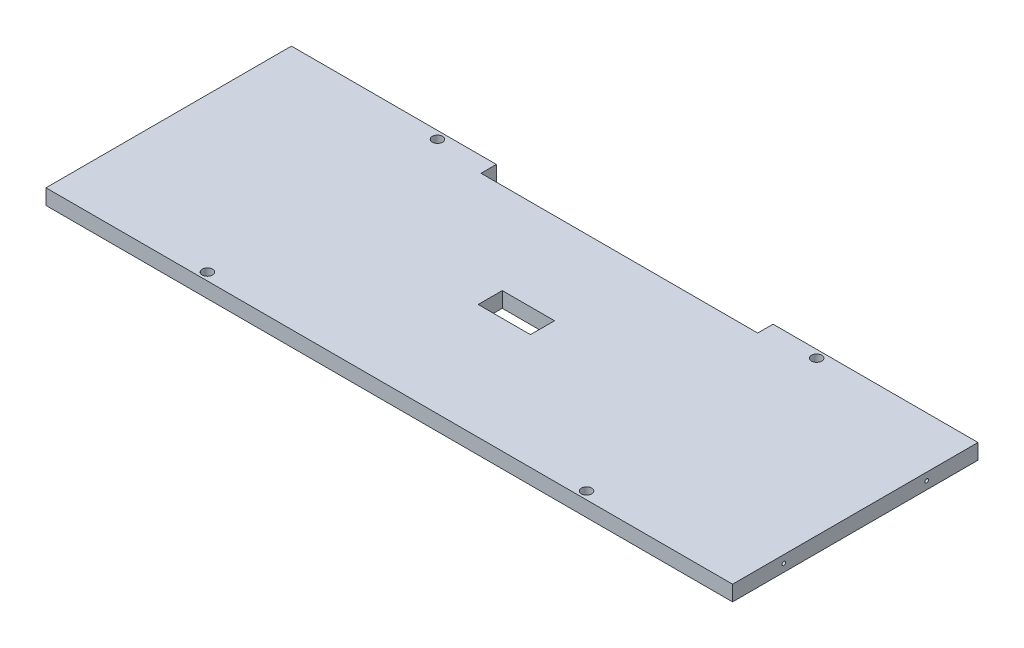
from build123d import *

# Parameters (mm, degrees)
SKETCH_1_W          = 134
SKETCH_1_H          = 3
EXTRUDE_1_DEPTH     = 47.9
SKETCH_4_R          = 0.7
SKETCH_4_W          = 10.2
SKETCH_4_H          = 4.7
SKETCH_4_W_2        = 54
SKETCH_4_H_2        = 3
CUT_EXTRUDE_1_DEPTH = 83.416078528
SKETCH_4_3_R        = 1
SKETCH_4_3_R_2      = 0.7
SKETCH_4_3_W        = 10.2
SKETCH_4_3_H        = 4.7
SKETCH_4_3_W_2      = 54
SKETCH_4_3_H_2      = 3
CUT_EXTRUDE_2_DEPTH = 1.5
SKETCH_5_R          = 0.35
CUT_EXTRUDE_3_DEPTH = 1.5
SKETCH_6_R          = 0.35
CUT_EXTRUDE_4_DEPTH = 1.5
SKETCH_7_R          = 0.35
CUT_EXTRUDE_5_DEPTH = 1.5
CUT_EXTRUDE_START   = -132.5
SKETCH_7_3_R        = 0.35
CUT_EXTRUDE_6_DEPTH = 1.5


with BuildPart() as part:
    # 草图1 → 凸台-拉伸1 (new body)
    with BuildSketch(Plane.XY):
        Rectangle(SKETCH_1_W, SKETCH_1_H)
    extrude(amount=EXTRUDE_1_DEPTH)

    # 草图4 → 切除-拉伸1 (cut, through all)
    with BuildSketch(Plane(origin=(0, 1.5, 0), x_dir=(1, 0, 0), z_dir=(0, 1, 0))):
        with Locations(Location((37, -46.4, 0), (0, 0, 270))):
            Circle(SKETCH_4_R)
        with Locations(Location((-37, -46.4, 0), (0, 0, 270))):
            Circle(SKETCH_4_R)
        with Locations((0, -23.1)):
            Rectangle(SKETCH_4_W, SKETCH_4_H)
        with Locations((0, -1.5)):
            Rectangle(SKETCH_4_W_2, SKETCH_4_H_2)
        with Locations(Location((-37, -1.5, 0), (0, 0, 270))):
            Circle(SKETCH_4_R)
        with Locations(Location((37, -1.5, 0), (0, 0, 270))):
            Circle(SKETCH_4_R)
    extrude(amount=-CUT_EXTRUDE_1_DEPTH, mode=Mode.SUBTRACT)

    # 草图4<3> → 切除-拉伸2 (cut)
    # profile 1 of 6: a face of its own
    with BuildSketch(Plane(origin=(0, 1.5, 0), x_dir=(1, 0, 0), z_dir=(0, 1, 0))):
        with Locations(Location((-37, -46.4, 0), (0, 0, 270))):
            Circle(SKETCH_4_3_R)
        with Locations(Location((-37, -46.4, 0), (0, 0, 270))):
            Circle(SKETCH_4_3_R_2, mode=Mode.SUBTRACT)
    # profile 2 of 6: a face of its own
    with BuildSketch(Plane(origin=(0, 1.5, 0), x_dir=(1, 0, 0), z_dir=(0, 1, 0))):
        with Locations(Location((37, -46.4, 0), (0, 0, 270))):
            Circle(SKETCH_4_3_R)
        with Locations(Location((37, -46.4, 0), (0, 0, 270))):
            Circle(SKETCH_4_3_R_2, mode=Mode.SUBTRACT)
    # profile 3 of 6: a face of its own
    with BuildSketch(Plane(origin=(0, 1.5, 0), x_dir=(1, 0, 0), z_dir=(0, 1, 0))):
        with Locations(Location((37, -1.5, 0), (0, 0, 270))):
            Circle(SKETCH_4_3_R)
        with Locations(Location((37, -1.5, 0), (0, 0, 270))):
            Circle(SKETCH_4_3_R_2, mode=Mode.SUBTRACT)
    # profile 4 of 6: a face of its own
    with BuildSketch(Plane(origin=(0, 1.5, 0), x_dir=(1, 0, 0), z_dir=(0, 1, 0))):
        with Locations(Location((-37, -1.5, 0), (0, 0, 270))):
            Circle(SKETCH_4_3_R)
        with Locations(Location((-37, -1.5, 0), (0, 0, 270))):
            Circle(SKETCH_4_3_R_2, mode=Mode.SUBTRACT)
    # profile 5 of 6: a face of its own
    with BuildSketch(Plane(origin=(0, 1.5, 0), x_dir=(1, 0, 0), z_dir=(0, 1, 0))):
        with Locations((0, -23.1)):
            Rectangle(SKETCH_4_3_W, SKETCH_4_3_H)
    # profile 6 of 6: a face of its own
    with BuildSketch(Plane(origin=(0, 1.5, 0), x_dir=(1, 0, 0), z_dir=(0, 1, 0))):
        with Locations((0, -1.5)):
            Rectangle(SKETCH_4_3_W_2, SKETCH_4_3_H_2)
    extrude(amount=-CUT_EXTRUDE_2_DEPTH, mode=Mode.SUBTRACT)

    # 草图5 → 切除-拉伸3 (cut)
    with BuildSketch(Plane.XZ.offset(1.5)):
        with Locations((42.3, 22.35)):
            Circle(SKETCH_5_R)
        with Locations((-42.3, 22.35)):
            Circle(SKETCH_5_R)
    extrude(amount=-CUT_EXTRUDE_3_DEPTH, mode=Mode.SUBTRACT)

    # 草图6 → 切除-拉伸4 (cut)
    with BuildSketch(Plane(origin=(0, 0, 3), x_dir=(-1, 0, 0), z_dir=(0, 0, -1))):
        Circle(SKETCH_6_R)
    extrude(amount=-CUT_EXTRUDE_4_DEPTH, mode=Mode.SUBTRACT)

    # 草图7 → 切除-拉伸5 (cut)
    with BuildSketch(Plane(origin=(67, 0, 0), x_dir=(0, 0, -1), z_dir=(1, 0, 0))):
        with Locations((-10, 0)):
            Circle(SKETCH_7_R)
        with Locations((-37.9, 0)):
            Circle(SKETCH_7_R)
    extrude(amount=-CUT_EXTRUDE_5_DEPTH, mode=Mode.SUBTRACT)

    # 草图7<3> → 切除-拉伸6 (cut)
    with BuildSketch(Plane(origin=(67, 0, 0), x_dir=(0, 0, -1), z_dir=(1, 0, 0)).offset(CUT_EXTRUDE_START)):
        with Locations((-10, 0)):
            Circle(SKETCH_7_3_R)
        with Locations((-37.9, 0)):
            Circle(SKETCH_7_3_R)
    extrude(amount=-CUT_EXTRUDE_6_DEPTH, mode=Mode.SUBTRACT)


solid = part.part
